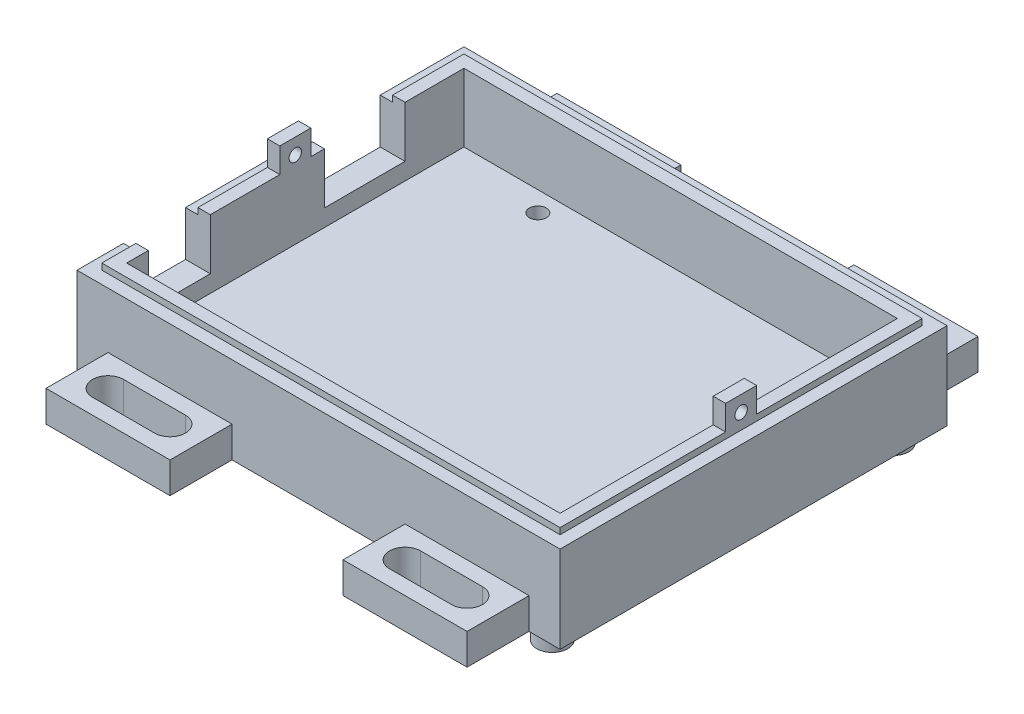
from build123d import *

# Parameters (mm, degrees)
SKETCH1_W               = 77.9
SKETCH1_H               = 62.4
SKETCH1_W_2             = 69.9
SKETCH1_H_2             = 54.4
BOSS_EXTRUDE1_DEPTH     = 10
SKETCH2_W               = 77.9
SKETCH2_H               = 62.4
BOSS_EXTRUDE2_DEPTH     = 4
SKETCH7_W               = 73.9
SKETCH7_H               = 58.4
SKETCH7_W_2             = 69.9
SKETCH7_H_2             = 54.4
BOSS_EXTRUDE4_DEPTH     = 1
CUT_EXTRUDE1_REACH      = 99.979
SKETCH3_W               = 13
SKETCH3_H               = 7.25
CUT_EXTRUDE2_REACH      = 99.979
SKETCH4_W               = 10
SKETCH4_H               = 7.25
SKETCH5_R               = 1.36925
CUT_EXTRUDE4_DEPTH      = 25
SKETCH6_R               = 2.5
BOSS_EXTRUDE3_DEPTH     = 3
SKETCH9_W               = 10
SKETCH9_H               = 1
SKETCH9_W_2             = 13
CUT_EXTRUDE5_DEPTH      = 11
SKETCH11_W              = 5
SKETCH11_H              = 5
SKETCH11_R              = 1
BOSS_EXTRUDE5_DEPTH     = 2
BOSS_EXTRUDE6_START     = -2
SKETCH12_W              = 5
SKETCH12_H              = 5
SKETCH12_R              = 1
BOSS_EXTRUDE6_DEPTH     = 2
SKETCH13_W              = 20
SKETCH13_H              = 5
BOSS_EXTRUDE7_DEPTH     = 10
CUT_EXTRUDE6_DEPTH      = 10
MIRROR2_COPY_1_SKETCH_W = 20
MIRROR2_COPY_1_SKETCH_H = 5
MIRROR2_COPY_1_DEPTH    = 10
MIRROR2_COPY_2_DEPTH    = 10


with BuildPart() as part:
    # Sketch1 → Boss-Extrude1 (new body)
    with BuildSketch(Plane(origin=(0, 0, 0), x_dir=(1, 0, 0), z_dir=(0, 1, 0))):
        with Locations((34.95, 27.2)):
            Rectangle(SKETCH1_W, SKETCH1_H)
        with Locations((34.95, 27.2)):
            Rectangle(SKETCH1_W_2, SKETCH1_H_2, mode=Mode.SUBTRACT)
    extrude(amount=BOSS_EXTRUDE1_DEPTH)

    # Sketch2 → Boss-Extrude2 (add)
    with BuildSketch(Plane(origin=(0, 0, 0), x_dir=(1, 0, 0), z_dir=(0, 1, 0))):
        with Locations((34.95, 27.2)):
            Rectangle(SKETCH2_W, SKETCH2_H)
    extrude(amount=-BOSS_EXTRUDE2_DEPTH)

    # Sketch7 → Boss-Extrude4 (add)
    with BuildSketch(Plane(origin=(0, 10, 0), x_dir=(1, 0, 0), z_dir=(0, 1, 0))):
        with Locations((34.95, 27.2)):
            Rectangle(SKETCH7_W, SKETCH7_H)
        with Locations((34.95, 27.2)):
            Rectangle(SKETCH7_W_2, SKETCH7_H_2, mode=Mode.SUBTRACT)
    extrude(amount=BOSS_EXTRUDE4_DEPTH)

    # Sketch3 → Cut-Extrude1 (cut, up to next)
    with BuildSketch(Plane.ZY.offset(4), mode=Mode.PRIVATE) as cut_extrude1_sk1:
        with Locations((-38.4, 6.375)):
            Rectangle(SKETCH3_W, SKETCH3_H)
    cut_extrude1_tool1 = extrude(cut_extrude1_sk1.sketch, amount=-CUT_EXTRUDE1_REACH, mode=Mode.PRIVATE) & part.part
    add(cut_extrude1_tool1.solids().sort_by_distance((-4, 6.375, -38.4))[0], mode=Mode.SUBTRACT)

    # Sketch4 → Cut-Extrude2 (cut, up to next)
    with BuildSketch(Plane.ZY.offset(4), mode=Mode.PRIVATE) as cut_extrude2_sk1:
        with Locations((-8.5, 6.375)):
            Rectangle(SKETCH4_W, SKETCH4_H)
    cut_extrude2_tool1 = extrude(cut_extrude2_sk1.sketch, amount=-CUT_EXTRUDE2_REACH, mode=Mode.PRIVATE) & part.part
    add(cut_extrude2_tool1.solids().sort_by_distance((-4, 6.375, -8.5))[0], mode=Mode.SUBTRACT)

    # Sketch5 → Cut-Extrude4 (cut, symmetric)
    with BuildSketch(Plane(origin=(0, -4, 0), x_dir=(-1, 0, 0), z_dir=(0, -1, 0))):
        with Locations(Location((-65.94475, 7.99125, 0), (0, 0, 270))):
            Circle(SKETCH5_R)
        with Locations(Location((-15.15745, 51.15855, 0), (0, 0, 270))):
            Circle(SKETCH5_R)
        with Locations(Location((-65.94475, 35.91855, 0), (0, 0, 270))):
            Circle(SKETCH5_R)
        with Locations(Location((-14.01445, 3.24145, 0), (0, 0, 270))):
            Circle(SKETCH5_R)
    extrude(amount=CUT_EXTRUDE4_DEPTH, both=True, mode=Mode.SUBTRACT)

    # Sketch6 → Boss-Extrude3 (add)
    with BuildSketch(Plane(origin=(0, -4, 0), x_dir=(-1, 0, 0), z_dir=(0, -1, 0))):
        with Locations(Location((-0.95, -0.3, 0), (0, 0, 270))):
            Circle(SKETCH6_R)
        with Locations(Location((-0.95, 54.7, 0), (0, 0, 270))):
            Circle(SKETCH6_R)
        with Locations(Location((-68.95, 54.7, 0), (0, 0, 270))):
            Circle(SKETCH6_R)
        with Locations(Location((-68.95, -0.3, 0), (0, 0, 270))):
            Circle(SKETCH6_R)
    extrude(amount=BOSS_EXTRUDE3_DEPTH)

    # Sketch9 → Cut-Extrude5 (cut)
    with BuildSketch(Plane.ZY.offset(2)):
        with Locations((-8.5, 10.5)):
            Rectangle(SKETCH9_W, SKETCH9_H)
        with Locations((-38.4, 10.5)):
            Rectangle(SKETCH9_W_2, SKETCH9_H)
    extrude(amount=-CUT_EXTRUDE5_DEPTH, mode=Mode.SUBTRACT)

    # Sketch11 → Boss-Extrude5 (add)
    with BuildSketch(Plane(origin=(71.9, 0, 0), x_dir=(0, 0, -1), z_dir=(1, 0, 0))):
        with Locations((27.2, 12.5)):
            Rectangle(SKETCH11_W, SKETCH11_H)
        with Locations((27.2, 12.5)):
            Circle(SKETCH11_R, mode=Mode.SUBTRACT)
    extrude(amount=-BOSS_EXTRUDE5_DEPTH)

    # Sketch12 → Boss-Extrude6 (add)
    with BuildSketch(Plane.ZY.offset(2).offset(BOSS_EXTRUDE6_START)):
        with Locations((-27.2, 12.5)):
            Rectangle(SKETCH12_W, SKETCH12_H)
        with Locations(Location((-27.2, 12.5, 0), (0, 0, 180))):
            Circle(SKETCH12_R, mode=Mode.SUBTRACT)
    extrude(amount=BOSS_EXTRUDE6_DEPTH)

    # Sketch13 → Boss-Extrude7 (add)
    with BuildSketch(Plane(origin=(0, 0, -58.4), x_dir=(-1, 0, 0), z_dir=(0, 0, -1))):
        with Locations((-58.9, -1.5)):
            Rectangle(SKETCH13_W, SKETCH13_H)
    boss_extrude7 = extrude(amount=BOSS_EXTRUDE7_DEPTH)

    # Sketch14 → Cut-Extrude6 (cut)
    with BuildSketch(Plane(origin=(0, 1, 0), x_dir=(1, 0, 0), z_dir=(0, 1, 0))):
        with BuildLine():
            Line((63.9, 60.9), (53.9, 60.9))
            ThreePointArc((53.9, 60.9), (51.4, 63.4), (53.9, 65.9))
            Line((53.9, 65.9), (63.9, 65.9))
            ThreePointArc((63.9, 65.9), (66.4, 63.4), (63.9, 60.9))
        make_face()
    cut_extrude6 = extrude(amount=-CUT_EXTRUDE6_DEPTH, mode=Mode.SUBTRACT)

    # Mirror1: Boss-Extrude7, Cut-Extrude6 across plane
    add(boss_extrude7.mirror(Plane(origin=(0, 0, -27.2), x_dir=(1, 0, 0), z_dir=(0, 0, -1))))
    add(cut_extrude6.mirror(Plane(origin=(0, 0, -27.2), x_dir=(1, 0, 0), z_dir=(0, 0, -1))), mode=Mode.SUBTRACT)

    # Mirror2: Boss-Extrude7, Cut-Extrude6 across plane
    add(boss_extrude7.mirror(Plane.ZY.offset(-34.95)))
    add(cut_extrude6.mirror(Plane.ZY.offset(-34.95)), mode=Mode.SUBTRACT)

    # Mirror2 copy 1 sketch → Mirror2 copy 1 (add)
    with BuildSketch(Plane(origin=(69.9, 0, 4), x_dir=(1, 0, 0), z_dir=(0, 0, 1))):
        with Locations((-58.9, -1.5)):
            Rectangle(MIRROR2_COPY_1_SKETCH_W, MIRROR2_COPY_1_SKETCH_H)
    extrude(amount=MIRROR2_COPY_1_DEPTH)

    # Mirror2 copy 2 sketch → Mirror2 copy 2 (cut)
    with BuildSketch(Plane(origin=(69.9, 1, -54.4), x_dir=(-1, 0, 0), z_dir=(0, 1, 0))):
        with BuildLine():
            Line((63.9, 60.9), (53.9, 60.9))
            ThreePointArc((53.9, 60.9), (51.4, 63.4), (53.9, 65.9))
            Line((53.9, 65.9), (63.9, 65.9))
            ThreePointArc((63.9, 65.9), (66.4, 63.4), (63.9, 60.9))
        make_face()
    extrude(amount=-MIRROR2_COPY_2_DEPTH, mode=Mode.SUBTRACT)


solid = part.part
